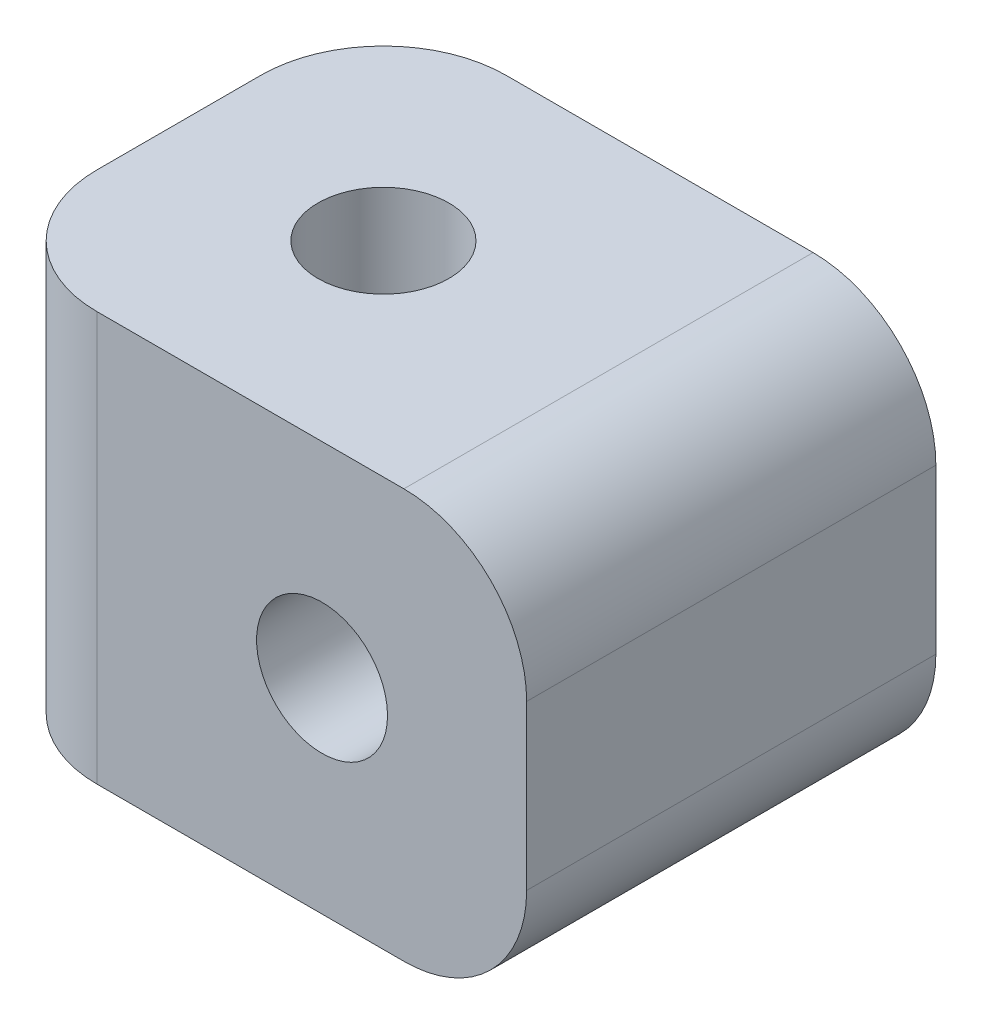
from build123d import *

# Parameters (mm, degrees)
SKETCH1_W           = 13.5
SKETCH1_H           = 10
BOSS_EXTRUDE1_DEPTH = 10
SKETCH2_R           = 1.6
CUT_EXTRUDE1_DEPTH  = 20.551214796
SKETCH3_R           = 1.6
CUT_EXTRUDE2_DEPTH  = 20.551214796
FILLET1_R           = 3


with BuildPart() as part:
    # Sketch1 → Boss-Extrude1 (new body)
    with BuildSketch(Plane(origin=(0, 0, 0), x_dir=(1, 0, 0), z_dir=(0, 1, 0))):
        with Locations((6.75, -5)):
            Rectangle(SKETCH1_W, SKETCH1_H)
    extrude(amount=BOSS_EXTRUDE1_DEPTH)

    # Sketch2 → Cut-Extrude1 (cut, through all)
    with BuildSketch(Plane.XY.offset(10)):
        with Locations((8.5, 5)):
            Circle(SKETCH2_R)
    extrude(amount=-CUT_EXTRUDE1_DEPTH, mode=Mode.SUBTRACT)

    # Sketch3 → Cut-Extrude2 (cut, through all)
    with BuildSketch(Plane(origin=(0, 10, 0), x_dir=(1, 0, 0), z_dir=(0, 1, 0))):
        with Locations(Location((5, -5, 0), (0, 0, 270))):
            Circle(SKETCH3_R)
    extrude(amount=-CUT_EXTRUDE2_DEPTH, mode=Mode.SUBTRACT)

    # Fillet1
    fillet1_edges = [part.edges().sort_by_distance(p)[0] for p in [
        (13.5, 10, 5),
        (13.5, 0, 5),
        (0, 5, 0),
        (0, 5, 10),
    ]]
    fillet(fillet1_edges, radius=FILLET1_R)


solid = part.part
